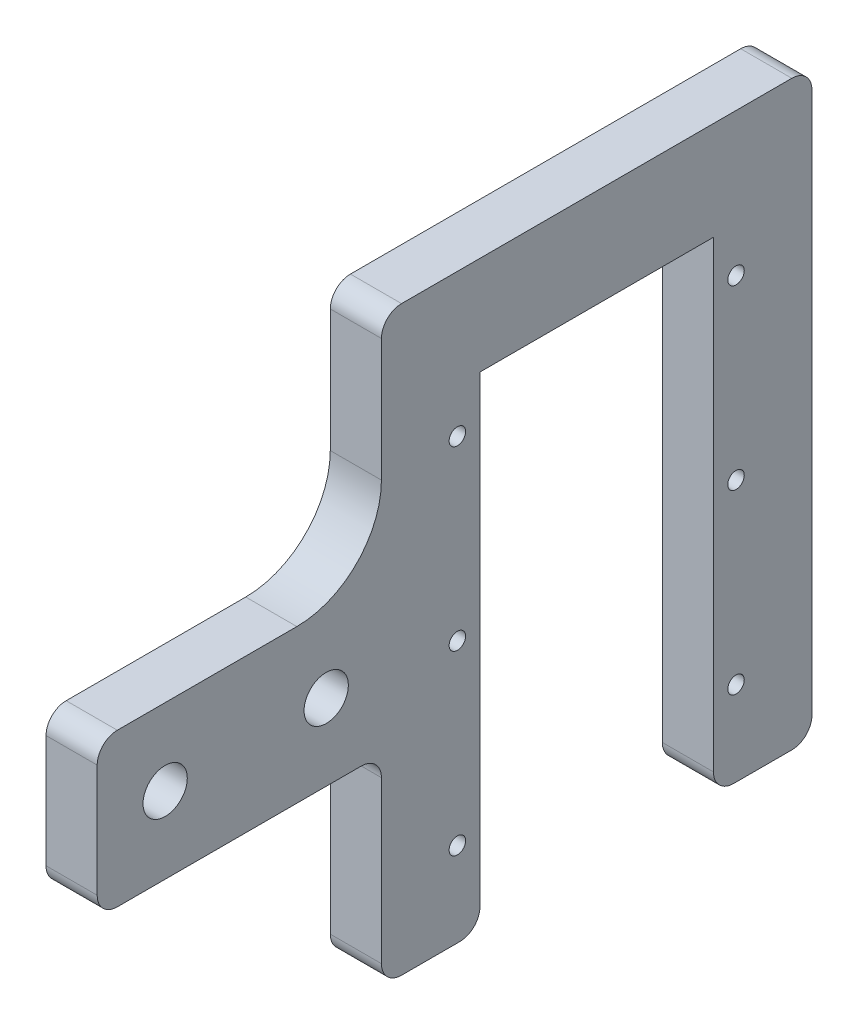
from build123d import *

# Parameters (mm, degrees)
SKETCH11_W           = 36.88
SKETCH11_H           = 19
BOSS_EXTRUDE3_DEPTH  = 3.175
BOSS_EXTRUDE2_DEPTH  = 3.175
SKETCH4_R            = 1.025
CUT_EXTRUDE4_DEPTH   = 80.923101916
M5_CLEARANCE_HOLE1_D = 5.5
FILLET1_R            = 2.5
FILLET2_R            = 10.5


with BuildPart() as part:
    # Sketch11 → Boss-Extrude3 (new, symmetric)
    with BuildSketch(Plane(origin=(0, 0, 0), x_dir=(0, 0, -1), z_dir=(1, 0, 0))):
        with Locations((-43.587249817, -15.5)):
            Rectangle(SKETCH11_W, SKETCH11_H)
    extrude(amount=BOSS_EXTRUDE3_DEPTH, both=True)

    # Sketch8 → Boss-Extrude2 (add, symmetric)
    with BuildSketch(Plane(origin=(0, 0, 0), x_dir=(0, 0, -1), z_dir=(1, 0, 0))):
        Polygon((14.5, 10), (14.5, -50), (26.73162128, -50), (26.73162128, 22.23162128), (-26.73162128, 22.23162128), (-26.73162128, -50), (-14.5, -50), (-14.5, 10), align=None)
    extrude(amount=BOSS_EXTRUDE2_DEPTH, both=True)

    # Sketch4 → Cut-Extrude4 (cut, through all)
    with BuildSketch(Plane.ZY.offset(3.175)):
        with Locations((17.3, -39.5)):
            Circle(SKETCH4_R)
        with Locations(Location((-17.3, -39.5, 0), (0, 0, 180))):
            Circle(SKETCH4_R)
        with Locations((17.3, -17.5)):
            Circle(SKETCH4_R)
        with Locations(Location((-17.3, -17.5, 0), (0, 0, 180))):
            Circle(SKETCH4_R)
        with Locations(Location((-17.3, 4.5, 0), (0, 0, 180))):
            Circle(SKETCH4_R)
        with Locations((17.3, 4.5)):
            Circle(SKETCH4_R)
    extrude(amount=-CUT_EXTRUDE4_DEPTH, mode=Mode.SUBTRACT)

    # M5 Clearance Hole1 (through all)
    with Locations(Plane(origin=(3.175, 0, 0), x_dir=(0, 0, -1), z_dir=(1, 0, 0))):
        with Locations((-53.587249817, -15.5), (-33.587249817, -15.5)):
            Hole(M5_CLEARANCE_HOLE1_D / 2)

    # Fillet1
    fillet1_edges = [part.edges().sort_by_distance(p)[0] for p in [
        (0, -25, 26.73162128),
        (0, 22.23162128, 26.73162128),
        (0, -50, -14.5),
        (0, -50, -26.73162128),
        (0, 22.23162128, -26.73162128),
        (0, -50, 26.73162128),
        (0, -50, 14.5),
        (0, -25, 62.027249817),
        (0, -6, 62.027249817),
    ]]
    fillet(fillet1_edges, radius=FILLET1_R)

    # Fillet2
    fillet2_edges = [part.edges().sort_by_distance(p)[0] for p in [
        (0, -6, 26.73162128),
    ]]
    fillet(fillet2_edges, radius=FILLET2_R)


solid = part.part
